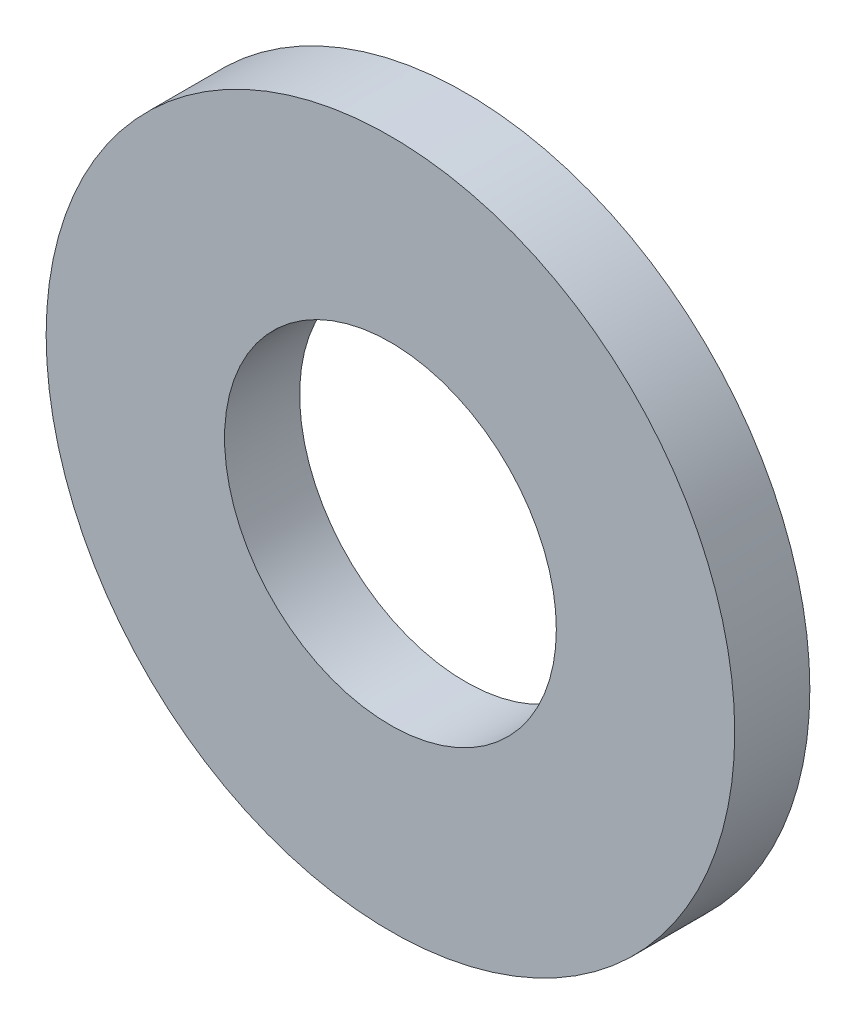
from build123d import *

# Parameters (mm, degrees)
SKETCH1_R           = 5.5
SKETCH1_R_2         = 2.65
BOSS_EXTRUDE1_DEPTH = 1.2


with BuildPart() as part:
    # Sketch1 → Boss-Extrude1 (new body)
    with BuildSketch(Plane.XY):
        Circle(SKETCH1_R)
        Circle(SKETCH1_R_2, mode=Mode.SUBTRACT)
    extrude(amount=BOSS_EXTRUDE1_DEPTH)


solid = part.part
